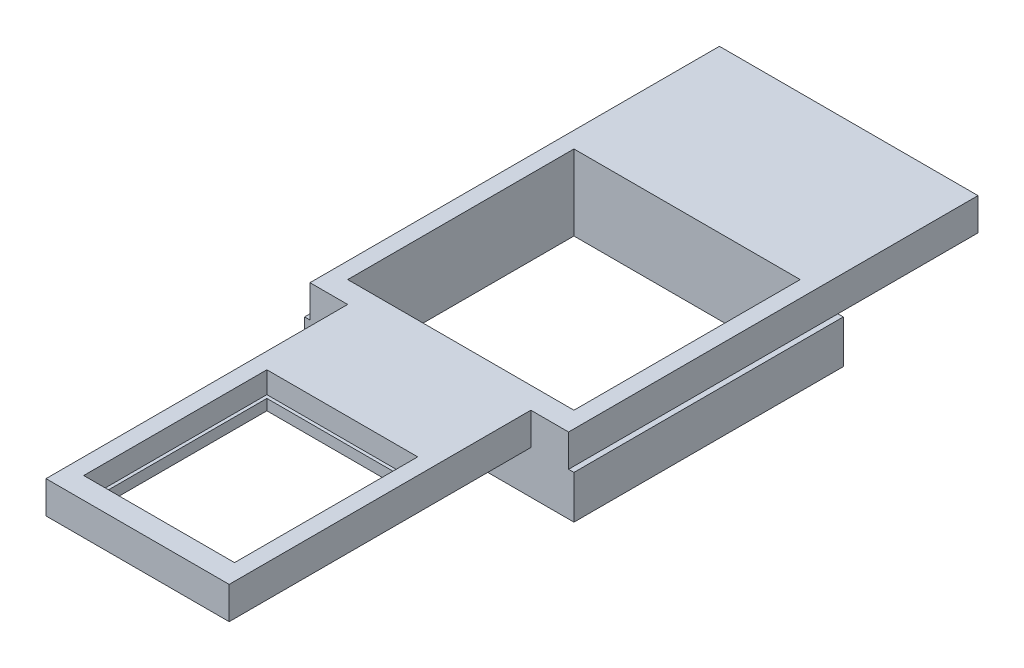
from build123d import *

# Parameters (mm, degrees)
SKETCH1_W           = 25
SKETCH1_H           = 25
BOSS_EXTRUDE1_DEPTH = 4
SKETCH2_W           = 24
SKETCH2_H           = 38
BOSS_EXTRUDE2_DEPTH = 3
SKETCH3_W           = 20
SKETCH3_H           = 2.25
CUT_EXTRUDE1_DEPTH  = 13
SKETCH4_W           = 17
SKETCH4_H           = 3
BOSS_EXTRUDE3_DEPTH = 28
CUT_EXTRUDE2_REACH  = 44.959
SKETCH5_W           = 14
SKETCH5_H           = 17
BOSS_EXTRUDE4_REACH = 48.856
SKETCH6_W           = 1
SKETCH6_H           = 2.25
CUT_EXTRUDE3_REACH  = 49.849
SKETCH7_W           = 2
SKETCH7_H           = 2.25
CUT_EXTRUDE4_REACH  = 44.959
SKETCH9_W           = 21
SKETCH9_H           = 21
SKETCH11_W          = 14
SKETCH11_H          = 17
SKETCH11_W_2        = 13.4
SKETCH11_H_2        = 16.4
BOSS_EXTRUDE5_DEPTH = 1


with BuildPart() as part:
    # Sketch1 → Boss-Extrude1 (new body)
    with BuildSketch(Plane(origin=(0, 0, 0), x_dir=(1, 0, 0), z_dir=(0, 1, 0))):
        Rectangle(SKETCH1_W, SKETCH1_H)
    extrude(amount=BOSS_EXTRUDE1_DEPTH)

    # Sketch2 → Boss-Extrude2 (add)
    with BuildSketch(Plane(origin=(0, 4, 0), x_dir=(1, 0, 0), z_dir=(0, 1, 0))):
        with Locations((0, 6.5)):
            Rectangle(SKETCH2_W, SKETCH2_H)
    extrude(amount=BOSS_EXTRUDE2_DEPTH)

    # Sketch3 → Cut-Extrude1 (cut)
    with BuildSketch(Plane(origin=(0, 0, -25.5), x_dir=(-1, 0, 0), z_dir=(0, 0, -1))):
        with Locations((0, 5.125)):
            Rectangle(SKETCH3_W, SKETCH3_H)
    extrude(amount=-CUT_EXTRUDE1_DEPTH, mode=Mode.SUBTRACT)

    # Sketch4 → Boss-Extrude3 (add)
    with BuildSketch(Plane.XY.offset(12.5)):
        with Locations((0, 5.5)):
            Rectangle(SKETCH4_W, SKETCH4_H)
    extrude(amount=BOSS_EXTRUDE3_DEPTH)

    # Sketch5 → Cut-Extrude2 (cut, up to next)
    with BuildSketch(Plane(origin=(0, 7, 0), x_dir=(1, 0, 0), z_dir=(0, 1, 0)), mode=Mode.PRIVATE) as cut_extrude2_sk1:
        with Locations((0, -30)):
            Rectangle(SKETCH5_W, SKETCH5_H)
    cut_extrude2_tool1 = extrude(cut_extrude2_sk1.sketch, amount=-CUT_EXTRUDE2_REACH, mode=Mode.PRIVATE) & part.part
    add(cut_extrude2_tool1.solids().sort_by_distance((0, 7, 30))[0], mode=Mode.SUBTRACT)

    # Sketch6 → Boss-Extrude4 (add, up to next)
    with BuildSketch(Plane(origin=(-10, 0, 0), x_dir=(0, 0, -1), z_dir=(1, 0, 0)), mode=Mode.PRIVATE) as boss_extrude4_sk1:
        with Locations((25, 5.125)):
            Rectangle(SKETCH6_W, SKETCH6_H)
    boss_extrude4_tool1 = extrude(boss_extrude4_sk1.sketch, amount=BOSS_EXTRUDE4_REACH, mode=Mode.PRIVATE) - part.part
    add(boss_extrude4_tool1.solids().sort_by_distance((-10, 5.125, -25))[0])

    # Sketch7 → Cut-Extrude3 (cut, up to next)
    with BuildSketch(Plane.ZY.offset(12), mode=Mode.PRIVATE) as cut_extrude3_sk1:
        with Locations((-18.5, 5.125)):
            Rectangle(SKETCH7_W, SKETCH7_H)
    cut_extrude3_tool1 = extrude(cut_extrude3_sk1.sketch, amount=-CUT_EXTRUDE3_REACH, mode=Mode.PRIVATE) & part.part
    add(cut_extrude3_tool1.solids().sort_by_distance((-12, 5.125, -18.5))[0], mode=Mode.SUBTRACT)

    # Sketch9 → Cut-Extrude4 (cut, up to next)
    with BuildSketch(Plane.XZ, mode=Mode.PRIVATE) as cut_extrude4_sk1:
        Rectangle(SKETCH9_W, SKETCH9_H)
    cut_extrude4_tool1 = extrude(cut_extrude4_sk1.sketch, amount=-CUT_EXTRUDE4_REACH, mode=Mode.PRIVATE) & part.part
    add(cut_extrude4_tool1.solids().sort_by_distance((0, 0, 0))[0], mode=Mode.SUBTRACT)

    # Sketch11 → Boss-Extrude5 (add)
    with BuildSketch(Plane.XZ.offset(-4)):
        with Locations((0, 30)):
            Rectangle(SKETCH11_W, SKETCH11_H)
        with Locations((0, 30)):
            Rectangle(SKETCH11_W_2, SKETCH11_H_2, mode=Mode.SUBTRACT)
    extrude(amount=-BOSS_EXTRUDE5_DEPTH)


solid = part.part
